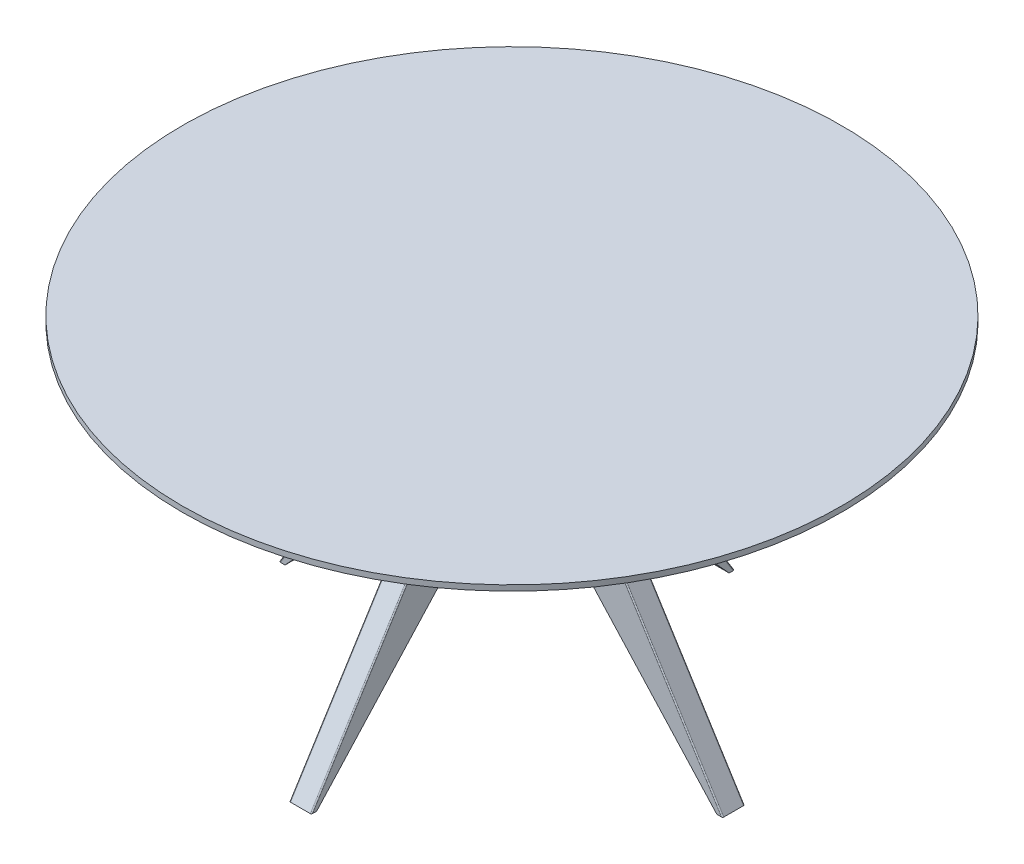
from build123d import *

# Parameters (mm, degrees)
SKETCH2_R           = 762
BOSS_EXTRUDE1_DEPTH = 12.7
BOSS_EXTRUDE2_DEPTH = 25.4
BOSS_EXTRUDE3_DEPTH = 25.4
FILLET1_R           = 50.8
FILLET2_R           = 50.8
FILLET3_R           = 2.54


with BuildPart() as part:
    # Sketch2 → Boss-Extrude1 (new body)
    with BuildSketch(Plane(origin=(0, 0, 0), x_dir=(1, 0, 0), z_dir=(0, 1, 0))):
        with Locations(Location((0, 0, 0), (0, 0, 270))):
            Circle(SKETCH2_R)
    extrude(amount=BOSS_EXTRUDE1_DEPTH)

    # Sketch3 → Boss-Extrude2 (add, symmetric)
    with BuildSketch(Plane(origin=(0, 0, 0), x_dir=(0, 0, -1), z_dir=(1, 0, 0))):
        with BuildLine():
            Line((-376.512914222, 0), (-519.686562072, 0))
            Line((-519.686562072, 0), (-222.871959454, -142.716140502))
            ThreePointArc((-222.871959454, -142.716140502), (-182.701733049, -190.186232292), (-191.275920014, -251.777952693))
            Line((-191.275920014, -251.777952693), (-489.061959381, -728.203177114))
            Line((-489.061959381, -728.203177114), (-476.851322016, -728.203177114))
            Line((-476.851322016, -728.203177114), (0, -205.292352404))
            Line((0, -205.292352404), (476.851322016, -728.203177114))
            Line((476.851322016, -728.203177114), (489.061959381, -728.203177114))
            Line((489.061959381, -728.203177114), (191.275920014, -251.777952693))
            ThreePointArc((191.275920014, -251.777952693), (182.701733049, -190.186232292), (222.871959454, -142.716140502))
            Line((222.871959454, -142.716140502), (519.686562072, 0))
            Line((519.686562072, 0), (376.512914222, 0))
            Line((376.512914222, 0), (0, -97.717234055))
            Line((0, -97.717234055), (-376.512914222, 0))
        make_face()
    extrude(amount=BOSS_EXTRUDE2_DEPTH, both=True)

    # Sketch5 → Boss-Extrude3 (add, symmetric)
    with BuildSketch(Plane.XY):
        with BuildLine():
            Line((-547.036781798, 0.405352419), (-249.591046968, -142.614252779))
            ThreePointArc((-249.591046968, -142.614252779), (-209.420820563, -190.08434457), (-217.995007528, -251.676064971))
            Line((-217.995007528, -251.676064971), (-512.749991198, -723.251930457))
            Line((-512.749991198, -723.251930457), (-499.148196201, -723.251930457))
            Line((-499.148196201, -723.251930457), (-3.147209779, -179.341757847))
            Line((-3.147209779, -179.341757847), (-3.147209779, -103.733008189))
            Line((-3.147209779, -103.733008189), (-404.401277334, 0.405352419))
            Line((-404.401277334, 0.405352419), (-547.036781798, 0.405352419))
        make_face()
        with BuildLine():
            ThreePointArc((249.591046968, -142.614252779), (209.420820563, -190.08434457), (217.995007528, -251.676064971))
            Line((217.995007528, -251.676064971), (512.749991198, -723.251930457))
            Line((512.749991198, -723.251930457), (499.148196201, -723.251930457))
            Line((499.148196201, -723.251930457), (3.147209779, -179.341757847))
            Line((3.147209779, -179.341757847), (3.147209779, -103.733008189))
            Line((3.147209779, -103.733008189), (404.401277334, 0.405352419))
            Line((404.401277334, 0.405352419), (547.036781798, 0.405352419))
            Line((547.036781798, 0.405352419), (249.591046968, -142.614252779))
        make_face()
    extrude(amount=BOSS_EXTRUDE3_DEPTH, both=True)

    # Fillet1
    fillet1_edges = [part.edges().sort_by_distance(p)[0] for p in [
        (25.4, -150.850828677, 25.4),
    ]]
    fillet(fillet1_edges, radius=FILLET1_R)

    # Fillet2
    fillet2_edges = [part.edges().sort_by_distance(p)[0] for p in [
        (-25.4, -150.850828677, -25.4),
        (-25.4, -150.850828677, 25.4),
        (25.4, -150.850828677, -25.4),
    ]]
    fillet(fillet2_edges, radius=FILLET2_R)

    # Fillet3
    fillet3_edges = [part.edges().sort_by_distance(p)[0] for p in [
        (-25.4, -489.990564904, 340.168939697),
        (25.4, -489.990564904, -340.168939697),
        (25.4, -190.186232292, -182.701733049),
        (25.4, -71.358070251, -371.279260763),
        (25.4, -71.358070251, 371.279260763),
        (25.4, -190.186232292, 182.701733049),
        (25.4, -489.990564904, 340.168939697),
        (-25.4, -71.358070251, -371.279260763),
        (-25.4, -190.186232292, -182.701733049),
        (-25.4, -489.990564904, -340.168939697),
        (-397.892397529, -71.30712639, -25.4),
        (-397.892397529, -71.30712639, 25.4),
        (-209.420820563, -190.08434457, 25.4),
        (-365.372499363, -487.463997714, 25.4),
        (-209.420820563, -190.08434457, -25.4),
        (-365.372499363, -487.463997714, -25.4),
        (397.892397529, -71.30712639, 25.4),
        (397.892397529, -71.30712639, -25.4),
        (209.420820563, -190.08434457, -25.4),
        (365.372499363, -487.463997714, -25.4),
        (209.420820563, -190.08434457, 25.4),
        (365.372499363, -487.463997714, 25.4),
        (-25.4, -71.358070251, 371.279260763),
        (-25.4, -190.186232292, 182.701733049),
    ]]
    fillet(fillet3_edges, radius=FILLET3_R)


solid = part.part
